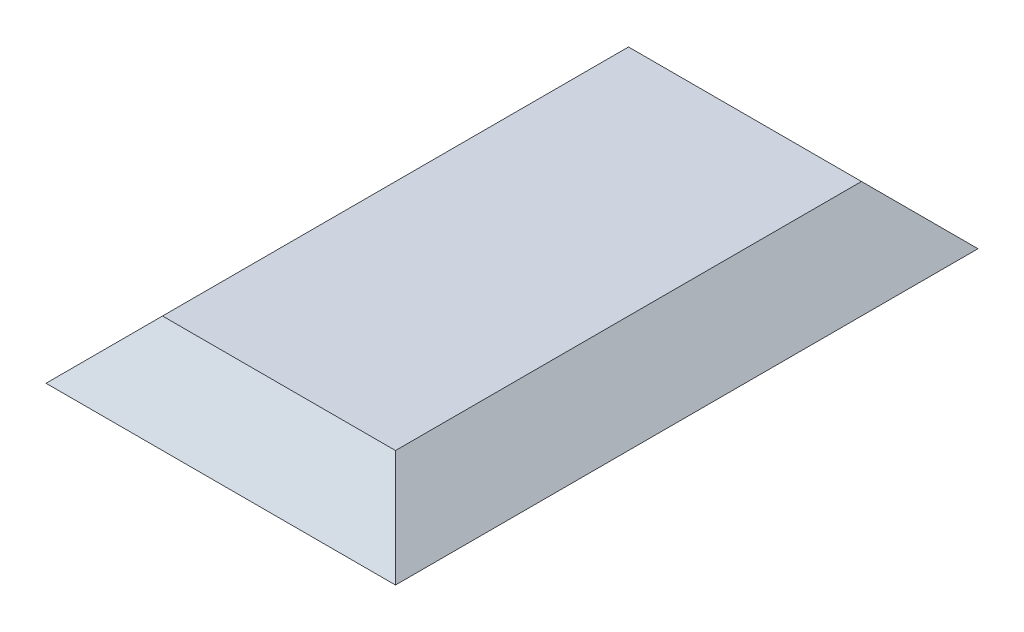
from build123d import *

# Parameters (mm, degrees)
BOSS_EXTRUDE1_DEPTH     = 381
CUT_EXTRUDE1_DEPTH      = 451.805279472
CUT_EXTRUDE1_DEPTH_BACK = 451.805279472
SHELL2_T                = -12.7


with BuildPart() as part:
    # Sketch1 → Boss-Extrude1 (new, symmetric)
    with BuildSketch(Plane.XY):
        Polygon((-228.6, 0), (228.6, 0), (152.4, 76.2), (-152.4, 76.2), align=None)
    extrude(amount=BOSS_EXTRUDE1_DEPTH, both=True)

    # Sketch2 → Cut-Extrude1 (cut, two sides: drawn at the far end of the back side and taken through both)
    with BuildSketch(Plane(origin=(0, 0, 0), x_dir=(0, 0, -1), z_dir=(1, 0, 0)).offset(-CUT_EXTRUDE1_DEPTH_BACK)):
        Polygon((-381, 0), (-381, 76.2), (-304.8, 76.2), align=None)
        Polygon((381, 0), (381, 76.2), (304.8, 76.2), align=None)
    extrude(amount=CUT_EXTRUDE1_DEPTH + CUT_EXTRUDE1_DEPTH_BACK, mode=Mode.SUBTRACT)

    # Shell2
    shell2_openings = [part.faces().sort_by_distance(p)[0] for p in [
        (0, 0, 0),
    ]]
    offset(amount=SHELL2_T, openings=shell2_openings, kind=Kind.INTERSECTION)


solid = part.part
